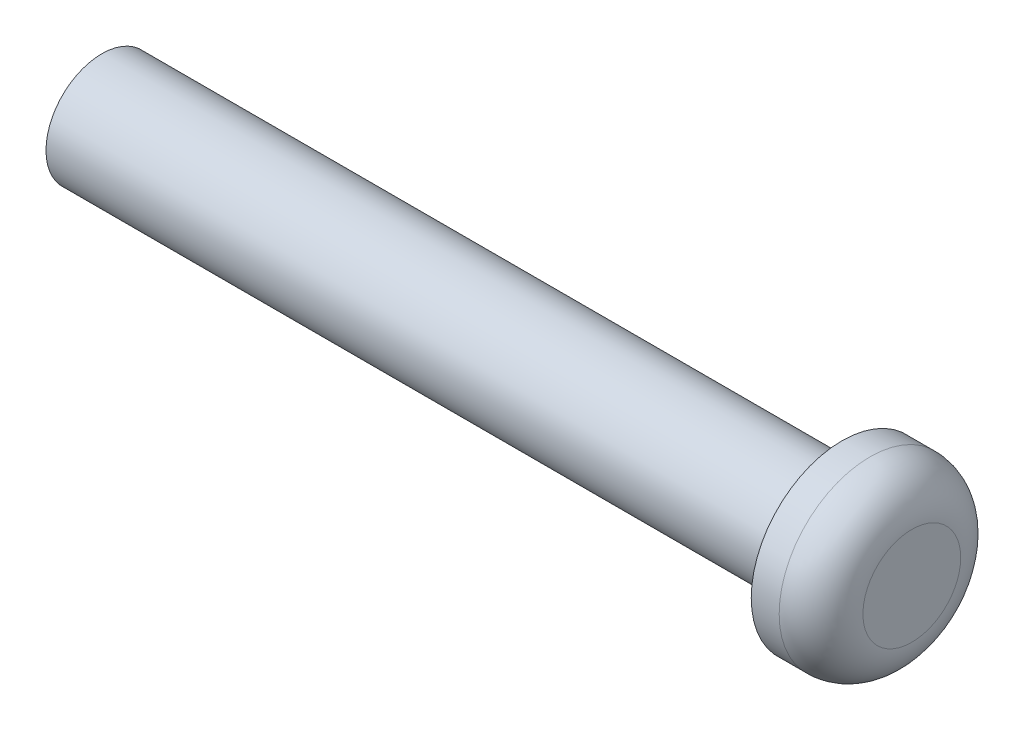
from build123d import *

# Parameters (mm, degrees)
SKETCH1_R           = 6.5
BOSS_EXTRUDE1_DEPTH = 5
SKETCH2_R           = 4
BOSS_EXTRUDE2_DEPTH = 53
FILLET1_R           = 3


with BuildPart() as part:
    # Sketch1 → Boss-Extrude1 (new body)
    with BuildSketch(Plane(origin=(0, 0, 0), x_dir=(0, 0, -1), z_dir=(1, 0, 0))):
        Circle(SKETCH1_R)
    extrude(amount=BOSS_EXTRUDE1_DEPTH)

    # Sketch2 → Boss-Extrude2 (add)
    with BuildSketch(Plane.ZY):
        with Locations(Location((0, 0, 0), (0, 0, 180))):
            Circle(SKETCH2_R)
    extrude(amount=BOSS_EXTRUDE2_DEPTH)

    # Fillet1
    fillet1_edges = [part.edges().sort_by_distance(p)[0] for p in [
        (5, 0, 6.5),
    ]]
    fillet(fillet1_edges, radius=FILLET1_R)


solid = part.part
